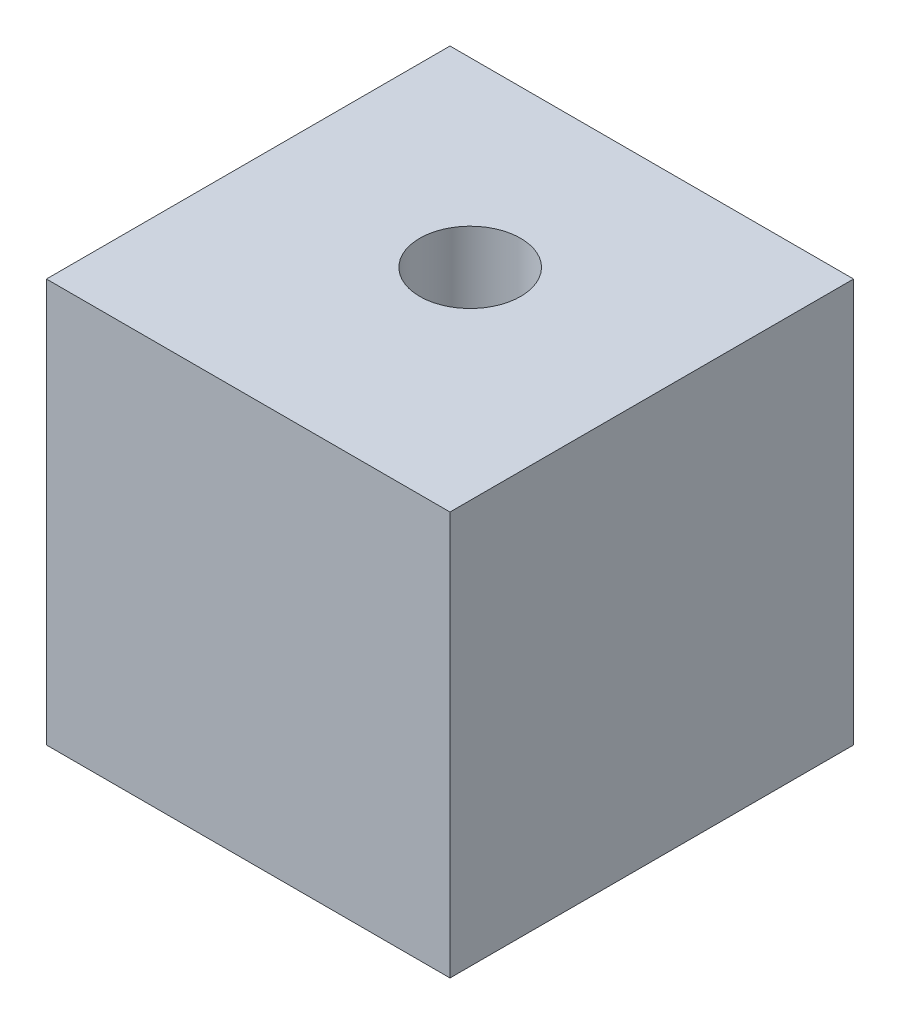
from build123d import *

# Parameters (mm, degrees)
SKETCH_1_W          = 10
SKETCH_1_H          = 10
EXTRUDE_1_DEPTH     = 10
SKETCH_3_R          = 1.25
CUT_EXTRUDE_1_DEPTH = 10


with BuildPart() as part:
    # 草图1 → 凸台-拉伸1 (new body)
    with BuildSketch(Plane(origin=(0, 0, 0), x_dir=(1, 0, 0), z_dir=(0, 1, 0))):
        with Locations((5, 5)):
            Rectangle(SKETCH_1_W, SKETCH_1_H)
    extrude(amount=EXTRUDE_1_DEPTH)

    # 草图3 → 切除-拉伸1 (cut)
    with BuildSketch(Plane(origin=(0, 10, 0), x_dir=(1, 0, 0), z_dir=(0, 1, 0))):
        with Locations(Location((5, 5.5, 0), (0, 0, 270))):
            Circle(SKETCH_3_R)
    extrude(amount=-CUT_EXTRUDE_1_DEPTH, mode=Mode.SUBTRACT)


solid = part.part
